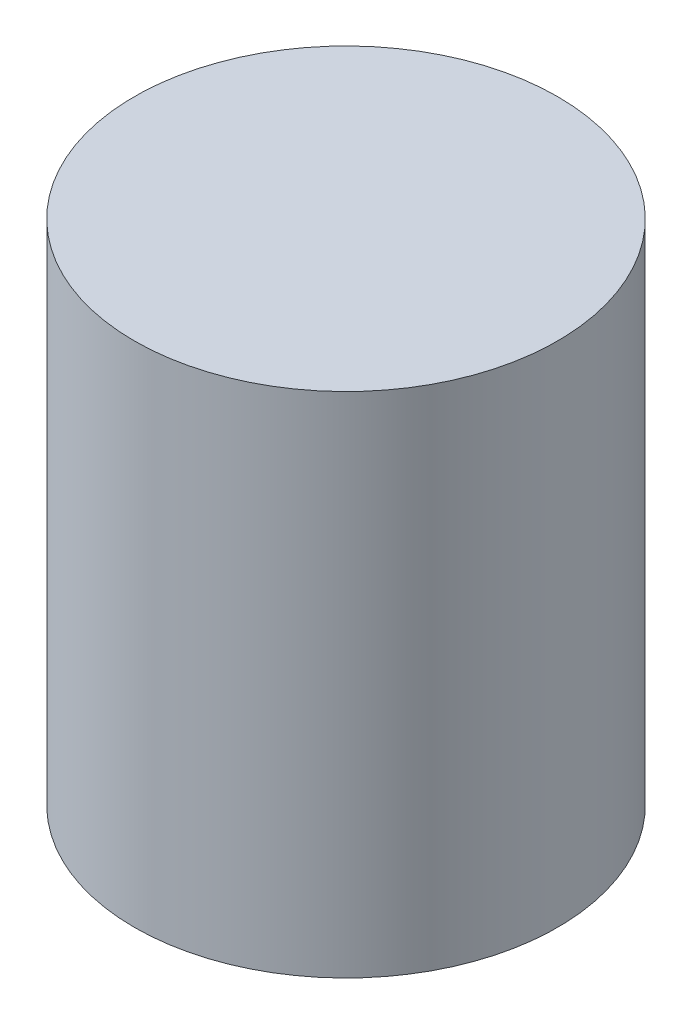
from build123d import *

# Parameters (mm, degrees)
SKETCH_1_R          = 25
EXTRUDE_1_DEPTH     = 60
SKETCH_2_R          = 22
CUT_EXTRUDE_1_DEPTH = 56
SKETCH_3_R          = 22
SKETCH_3_R_2        = 10
EXTRUDE_2_DEPTH     = 4


with BuildPart() as part:
    # 草图1 → 凸台-拉伸1 (new body)
    with BuildSketch(Plane(origin=(0, 0, 0), x_dir=(1, 0, 0), z_dir=(0, 1, 0))):
        with Locations(Location((0, 0, 0), (0, 0, 270))):
            Circle(SKETCH_1_R)
    extrude(amount=EXTRUDE_1_DEPTH)

    # 草图2 → 切除-拉伸1 (cut)
    with BuildSketch(Plane.XZ):
        with Locations(Location((0, 0, 0), (0, 0, 270))):
            Circle(SKETCH_2_R)
    extrude(amount=-CUT_EXTRUDE_1_DEPTH, mode=Mode.SUBTRACT)

    # 草图3 → 凸台-拉伸2 (add)
    with BuildSketch(Plane.XZ):
        with Locations(Location((0, 0, 0), (0, 0, 270))):
            Circle(SKETCH_3_R)
        with Locations(Location((0, 0, 0), (0, 0, 270))):
            Circle(SKETCH_3_R_2, mode=Mode.SUBTRACT)
    extrude(amount=-EXTRUDE_2_DEPTH)


solid = part.part
